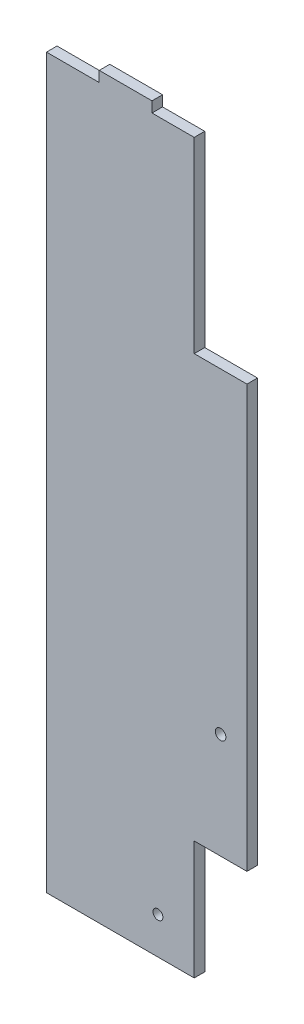
from build123d import *

# Parameters (mm, degrees)
SKETCH1_R           = 1.864189773
SKETCH1_R_2         = 2
BOSS_EXTRUDE1_DEPTH = 4


with BuildPart() as part:
    # Sketch1 → Boss-Extrude1 (new body)
    with BuildSketch(Plane.XY):
        Polygon((16, 65), (16, 136), (0, 136), (0, 140), (-20, 140), (-20, 136), (-40, 136), (-40, -140), (16, -140), (16, -95), (36, -95), (36, 65), align=None)
        with Locations((2.263986992, -126.02409254)):
            Circle(SKETCH1_R, mode=Mode.SUBTRACT)
        with Locations((26, -55)):
            Circle(SKETCH1_R_2, mode=Mode.SUBTRACT)
    extrude(amount=BOSS_EXTRUDE1_DEPTH)


solid = part.part
